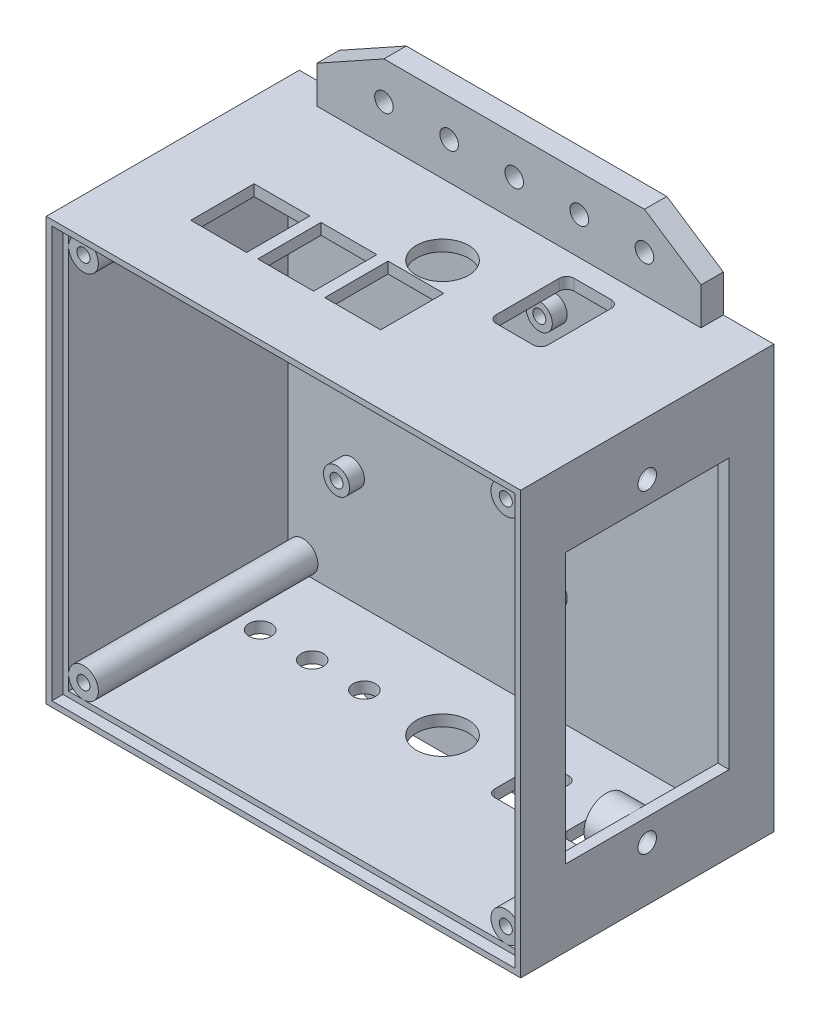
from build123d import *

# Parameters (mm, degrees)
CROQUIS1_R                 = 1.75
SALIENTE_EXTRUIR1_DEPTH    = 6
CROQUIS2_R                 = 3.5
CROQUIS2_R_2               = 1.75
SALIENTE_EXTRUIR2_DEPTH    = 10
CROQUIS3_R                 = 3.5
CROQUIS3_R_2               = 1.75
CORTAR_EXTRUIR1_DEPTH      = 3
SALIENTE_EXTRUIR9_DEPTH    = 68
CROQUIS4_R                 = 4
CROQUIS4_R_2               = 1.75
SALIENTE_EXTRUIR9_2_DEPTH  = 68
SALIENTE_EXTRUIR9_3_DEPTH  = 68
SALIENTE_EXTRUIR9_4_DEPTH  = 68
SALIENTE_EXTRUIR9_5_DEPTH  = 68
CROQUIS6_R                 = 2.5
CROQUIS6_W                 = 44
CROQUIS6_H                 = 72.5
CORTAR_EXTRUIR2_DEPTH      = 5
CROQUIS7_R                 = 6
CROQUIS7_R_2               = 2.5
SALIENTE_EXTRUIR10_DEPTH   = 8
CORTAR_EXTRUIR3_DEPTH      = 101
CORTAR_EXTRUIR3_DEPTH_BACK = 42
CROQUIS8_R                 = 7
CROQUIS9_R                 = 3
CORTAR_EXTRUIR4_DEPTH      = 42
CROQUIS10_W                = 15
CROQUIS10_H                = 17
CORTAR_EXTRUIR5_DEPTH      = 22
CROQUIS11_W                = 124.48
CROQUIS11_H                = 110.5
CORTAR_EXTRUIR6_DEPTH      = 3
CROQUIS12_R                = 2.5
SALIENTE_EXTRUIR11_DEPTH   = 6


with BuildPart() as part:
    # Croquis1 → Saliente-Extruir1 (new body)
    with BuildSketch(Plane.XY):
        Polygon((-74.48, 81), (53, 81), (53, -24.5), (53, -32.5), (-74.48, -32.5), (-74.48, -24.5), align=None)
        Circle(CROQUIS1_R, mode=Mode.SUBTRACT)
        with Locations((0, 66)):
            Circle(CROQUIS1_R, mode=Mode.SUBTRACT)
        with Locations((-54.48, 0.5)):
            Circle(CROQUIS1_R, mode=Mode.SUBTRACT)
    extrude(amount=SALIENTE_EXTRUIR1_DEPTH)

    # Croquis2 → Saliente-Extruir2 (add)
    # profile 1 of 3: a face of its own
    with BuildSketch(Plane.XY):
        with Locations(Location((-54.48, 0.5, 0), (0, 0, 180))):
            Circle(CROQUIS2_R)
        with Locations((-54.48, 0.5)):
            Circle(CROQUIS2_R_2, mode=Mode.SUBTRACT)
    # profile 2 of 3: a face of its own
    with BuildSketch(Plane.XY):
        with Locations(Location((0, 0, 0), (0, 0, 180))):
            Circle(CROQUIS2_R)
        Circle(CROQUIS2_R_2, mode=Mode.SUBTRACT)
    # profile 3 of 3: a face of its own
    with BuildSketch(Plane.XY):
        with Locations(Location((0, 66, 0), (0, 0, 180))):
            Circle(CROQUIS2_R)
        with Locations((0, 66)):
            Circle(CROQUIS2_R_2, mode=Mode.SUBTRACT)
    extrude(amount=SALIENTE_EXTRUIR2_DEPTH)

    # Croquis3 → Cortar-Extruir1 (cut)
    # profile 1 of 3: a face of its own
    with BuildSketch(Plane.XY):
        with Locations(Location((0, 66, 0), (0, 0, 180))):
            Circle(CROQUIS3_R)
        with Locations((0, 66)):
            Circle(CROQUIS3_R_2, mode=Mode.SUBTRACT)
    # profile 2 of 3: a face of its own
    with BuildSketch(Plane.XY):
        with Locations(Location((0, 0, 0), (0, 0, 180))):
            Circle(CROQUIS3_R)
        Circle(CROQUIS3_R_2, mode=Mode.SUBTRACT)
    # profile 3 of 3: a face of its own
    with BuildSketch(Plane.XY):
        with Locations(Location((-54.48, 0.5, 0), (0, 0, 180))):
            Circle(CROQUIS3_R)
        with Locations((-54.48, 0.5)):
            Circle(CROQUIS3_R_2, mode=Mode.SUBTRACT)
    extrude(amount=CORTAR_EXTRUIR1_DEPTH, mode=Mode.SUBTRACT)



with BuildPart() as body_2:
    # Croquis4 → Saliente-Extruir9 (new body)
    with BuildSketch(Plane.XY):
        Polygon((53, -32.5), (53, 81), (-74.48, 81), (-74.48, -24.5), (-74.48, -32.5), align=None)
        Polygon((-71.48, -25.5), (-71.48, -21.5), (-71.48, 74), (-71.48, 78), (-67.48, 78), (46.000000109, 78), (50, 78), (50, 74), (50, -21.5), (50, -25.5), (50, -29.5), (46.000000027, -29.5), (-67.48, -29.5), (-71.48, -29.5), align=None, mode=Mode.SUBTRACT)
    extrude(amount=SALIENTE_EXTRUIR9_DEPTH)

    # Croquis6 → Cortar-Extruir2 (cut)
    with BuildSketch(Plane(origin=(55, 0, 0), x_dir=(0, 0, -1), z_dir=(1, 0, 0))):
        with Locations((-34, 66.5)):
            Circle(CROQUIS6_R)
        with Locations((-34, -18)):
            Circle(CROQUIS6_R)
        with Locations((-34, 24.25)):
            Rectangle(CROQUIS6_W, CROQUIS6_H)
    extrude(amount=-CORTAR_EXTRUIR2_DEPTH, mode=Mode.SUBTRACT)

    # Croquis8 → Cortar-Extruir3 (cut, two sides: drawn at the far end of the back side and taken through both)
    with BuildSketch(Plane(origin=(0, 0, 0), x_dir=(1, 0, 0), z_dir=(0, 1, 0)).offset(-CORTAR_EXTRUIR3_DEPTH_BACK)):
        with Locations(Location((-11, -25, 0), (0, 0, 90))):
            Circle(CROQUIS8_R)
    extrude(amount=CORTAR_EXTRUIR3_DEPTH + CORTAR_EXTRUIR3_DEPTH_BACK, mode=Mode.SUBTRACT)

    # Croquis9 → Cortar-Extruir4 (cut)
    with BuildSketch(Plane(origin=(0, 0, 0), x_dir=(1, 0, 0), z_dir=(0, 1, 0))):
        with Locations(Location((-60, -25, 0), (0, 0, 270))):
            Circle(CROQUIS9_R)
        with Locations(Location((-46, -25, 0), (0, 0, 270))):
            Circle(CROQUIS9_R)
        with Locations(Location((-32, -25, 0), (0, 0, 270))):
            Circle(CROQUIS9_R)
        with BuildLine():
            Line((35, -32.5), (30, -32.5))
            ThreePointArc((30, -32.5), (28.585786438, -31.914213562), (28, -30.5))
            Line((28, -30.5), (28, -19.5))
            ThreePointArc((28, -19.5), (28.585786438, -18.085786438), (30, -17.5))
            Line((30, -17.5), (35, -17.5))
            ThreePointArc((35, -17.5), (36.414213562, -18.085786438), (37, -19.5))
            Line((37, -19.5), (37, -30.5))
            ThreePointArc((37, -30.5), (36.414213562, -31.914213562), (35, -32.5))
        make_face()
        with BuildLine():
            Line((15.5, -32.5), (10.5, -32.5))
            ThreePointArc((10.5, -32.5), (9.085786438, -31.914213562), (8.5, -30.5))
            Line((8.5, -30.5), (8.5, -19.5))
            ThreePointArc((8.5, -19.5), (9.085786438, -18.085786438), (10.5, -17.5))
            Line((10.5, -17.5), (15.5, -17.5))
            ThreePointArc((15.5, -17.5), (16.914213562, -18.085786438), (17.5, -19.5))
            Line((17.5, -19.5), (17.5, -30.5))
            ThreePointArc((17.5, -30.5), (16.914213562, -31.914213562), (15.5, -32.5))
        make_face()
    extrude(amount=-CORTAR_EXTRUIR4_DEPTH, mode=Mode.SUBTRACT)

    # Croquis10 → Cortar-Extruir5 (cut)
    with BuildSketch(Plane(origin=(0, 81, 0), x_dir=(1, 0, 0), z_dir=(0, 1, 0))):
        with BuildLine():
            Line((10.86, -32.5), (20.86, -32.5))
            ThreePointArc((20.86, -32.5), (22.274213562, -31.914213562), (22.86, -30.5))
            Line((22.86, -30.5), (22.86, -13.5))
            ThreePointArc((22.86, -13.5), (22.274213562, -12.085786438), (20.86, -11.5))
            Line((20.86, -11.5), (10.86, -11.5))
            ThreePointArc((10.86, -11.5), (9.445786438, -12.085786438), (8.86, -13.5))
            Line((8.86, -13.5), (8.86, -30.5))
            ThreePointArc((8.86, -30.5), (9.445786438, -31.914213562), (10.86, -32.5))
        make_face()
        with Locations((-10.64, -41)):
            Rectangle(CROQUIS10_W, CROQUIS10_H)
        with Locations((-28.64, -41)):
            Rectangle(CROQUIS10_W, CROQUIS10_H)
        with Locations((-46.64, -41)):
            Rectangle(CROQUIS10_W, CROQUIS10_H)
    extrude(amount=-CORTAR_EXTRUIR5_DEPTH, mode=Mode.SUBTRACT)


with BuildPart() as body_3:
    # Croquis4 → Saliente-Extruir9 2 (new body)
    with BuildSketch(Plane.XY):
        with Locations((-67.48, -25.5)):
            Circle(CROQUIS4_R)
        with Locations((-67.48, -25.5)):
            Circle(CROQUIS4_R_2, mode=Mode.SUBTRACT)
    extrude(amount=SALIENTE_EXTRUIR9_2_DEPTH)


with BuildPart() as body_4:
    # Croquis4 → Saliente-Extruir9 3 (new body)
    with BuildSketch(Plane.XY):
        with Locations((46, -25.5)):
            Circle(CROQUIS4_R)
        with Locations((46, -25.5)):
            Circle(CROQUIS4_R_2, mode=Mode.SUBTRACT)
    extrude(amount=SALIENTE_EXTRUIR9_3_DEPTH)



with BuildPart() as body_5:
    # Croquis4 → Saliente-Extruir9 4 (new body)
    with BuildSketch(Plane.XY):
        with Locations((46, 74)):
            Circle(CROQUIS4_R)
        with Locations((46, 74)):
            Circle(CROQUIS4_R_2, mode=Mode.SUBTRACT)
    extrude(amount=SALIENTE_EXTRUIR9_4_DEPTH)


with BuildPart() as body_6:
    # Croquis4 → Saliente-Extruir9 5 (new body)
    with BuildSketch(Plane.XY):
        with Locations((-67.48, 74)):
            Circle(CROQUIS4_R)
        with Locations((-67.48, 74)):
            Circle(CROQUIS4_R_2, mode=Mode.SUBTRACT)
    extrude(amount=SALIENTE_EXTRUIR9_5_DEPTH)


with BuildPart() as body_4_1:
    add(body_4.part)

    add(body_5.part)  # Saliente-Extruir10 merges body 5
    # Croquis7 → Saliente-Extruir10 (add)
    # profile 1 of 2: a face of its own
    with BuildSketch(Plane(origin=(50, 0, 0), x_dir=(0, 0, -1), z_dir=(1, 0, 0))):
        with Locations((-34, 66.5)):
            Circle(CROQUIS7_R)
        with Locations((-34, 66.5)):
            Circle(CROQUIS7_R_2, mode=Mode.SUBTRACT)
    # profile 2 of 2: a face of its own
    with BuildSketch(Plane(origin=(50, 0, 0), x_dir=(0, 0, -1), z_dir=(1, 0, 0))):
        with Locations((-34, -18)):
            Circle(CROQUIS7_R)
        with Locations((-34, -18)):
            Circle(CROQUIS7_R_2, mode=Mode.SUBTRACT)
    extrude(amount=-SALIENTE_EXTRUIR10_DEPTH)


with BuildPart() as cortar_extruir6_tool:
    # Croquis11 → Cortar-Extruir6 (new body)
    with BuildSketch(Plane.XY.offset(68)):
        with Locations((-10.74, 24.25)):
            Rectangle(CROQUIS11_W, CROQUIS11_H)
    extrude(amount=-CORTAR_EXTRUIR6_DEPTH)


with BuildPart() as body_2_1:
    add(body_2.part)

    # Cortar-Extruir6: cut by cortar_extruir6_tool
    add(cortar_extruir6_tool.part, mode=Mode.SUBTRACT)


with BuildPart() as body_3_1:
    add(body_3.part)

    # Cortar-Extruir6: cut by cortar_extruir6_tool
    add(cortar_extruir6_tool.part, mode=Mode.SUBTRACT)


with BuildPart() as body_4_2:
    add(body_4_1.part)

    # Cortar-Extruir6: cut by cortar_extruir6_tool
    add(cortar_extruir6_tool.part, mode=Mode.SUBTRACT)


with BuildPart() as body_6_1:
    add(body_6.part)

    # Cortar-Extruir6: cut by cortar_extruir6_tool
    add(cortar_extruir6_tool.part, mode=Mode.SUBTRACT)


with BuildPart() as part_1:
    add(part.part)

    add(body_2_1.part)  # Saliente-Extruir11 merges body 2
    # Croquis12 → Saliente-Extruir11 (add)
    # profile 1 of 2: a face of its own
    with BuildSketch(Plane.XY):
        Polygon((-63.74, 81), (39.448089368, 81), (39.448089368, 91), (24.26, 101), (-45.74, 101), (-63.74, 91), align=None)
        with Locations((-10.74, 91)):
            Circle(CROQUIS12_R, mode=Mode.SUBTRACT)
        with Locations((-45.74, 91)):
            Circle(CROQUIS12_R, mode=Mode.SUBTRACT)
        with Locations((24.26, 91)):
            Circle(CROQUIS12_R, mode=Mode.SUBTRACT)
        with Locations((-28.24, 91)):
            Circle(CROQUIS12_R, mode=Mode.SUBTRACT)
        with Locations((6.76, 91)):
            Circle(CROQUIS12_R, mode=Mode.SUBTRACT)
    # profile 2 of 2: a face of its own
    with BuildSketch(Plane.XY):
        Polygon((-45.74, -52.5), (24.26, -52.5), (39.448089368, -42.5), (39.448089368, -32.5), (-63.74, -32.5), (-63.74, -42.5), align=None)
        with Locations((-10.74, -42.5)):
            Circle(CROQUIS12_R, mode=Mode.SUBTRACT)
        with Locations((-45.74, -42.5)):
            Circle(CROQUIS12_R, mode=Mode.SUBTRACT)
        with Locations((24.26, -42.5)):
            Circle(CROQUIS12_R, mode=Mode.SUBTRACT)
        with Locations((-28.24, -42.5)):
            Circle(CROQUIS12_R, mode=Mode.SUBTRACT)
        with Locations((6.76, -42.5)):
            Circle(CROQUIS12_R, mode=Mode.SUBTRACT)
    extrude(amount=SALIENTE_EXTRUIR11_DEPTH)


solid = Compound([body_3_1.part, body_4_2.part, body_6_1.part, part_1.part])
